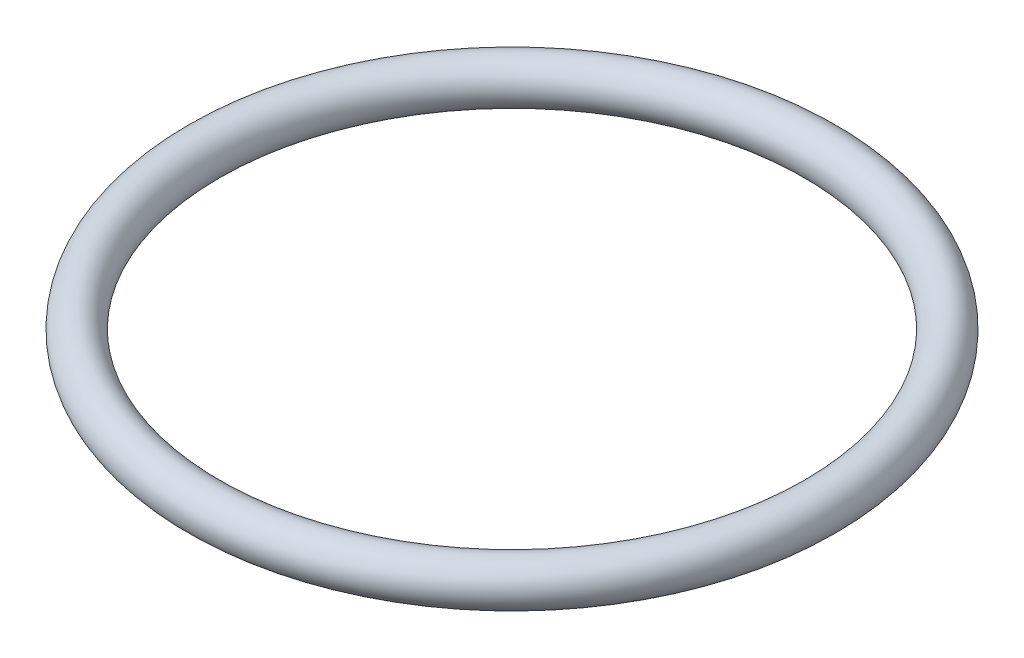
from build123d import *

# Parameters (mm, degrees)
SKETCH1_R = 0.90805


with BuildPart() as part:
    # Sketch1 → Revolve1 (revolve)
    with BuildSketch(Plane.XY):
        with Locations((-12.87145, 0)):
            Circle(SKETCH1_R)
    revolve(axis=Axis((0, 22.875948006, 0), (0, -1, 0)))


solid = part.part
